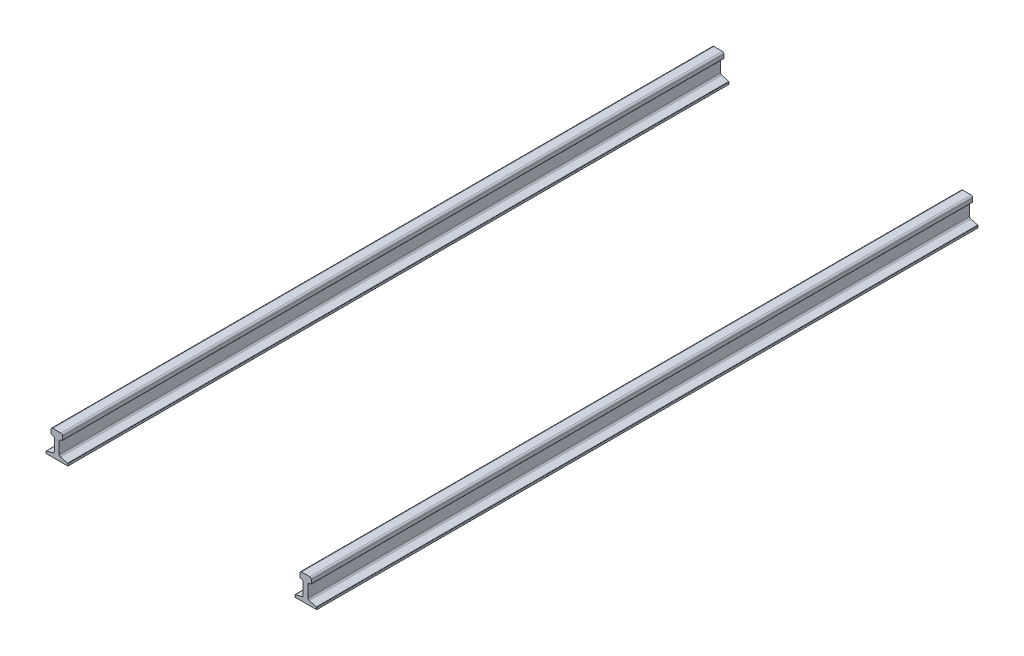
from build123d import *

# Parameters (mm, degrees)
EXTRUDE_1_DEPTH        = 4000
FILLET_1_R             = 10
FILLET_2_R             = 8
FILLET_3_R             = 3
FILLET_4_R             = 10
FILLET_5_R             = 3
PATTERN_LINEAR_1_COUNT = 2
PATTERN_LINEAR_1_PITCH = 1505


with BuildPart() as part:
    # 草图1 → 拉伸1 (new body)
    with BuildSketch(Plane.XY):
        Polygon((-35, 49.6), (-35, 83.5), (35, 83.5), (35, 49.6), (15, 44.6), (15, -41.6), (67, -54.6), (67, -68.5), (-65, -68.5), (-65, -54.6), (-15, -42.1), (-15, 44.6), align=None)
    extrude(amount=-EXTRUDE_1_DEPTH)

    # 圆角1
    fillet_1_edges = [part.edges().sort_by_distance(p)[0] for p in [
        (15, -41.6, -2000),
        (-15, -42.1, -2000),
    ]]
    fillet(fillet_1_edges, radius=FILLET_1_R)

    # 圆角2
    fillet_2_edges = [part.edges().sort_by_distance(p)[0] for p in [
        (15, 44.6, -2000),
        (-15, 44.6, -2000),
    ]]
    fillet(fillet_2_edges, radius=FILLET_2_R)

    # 圆角3
    fillet_3_edges = [part.edges().sort_by_distance(p)[0] for p in [
        (-35, 49.6, -2000),
        (35, 49.6, -2000),
    ]]
    fillet(fillet_3_edges, radius=FILLET_3_R)

    # 圆角4
    fillet_4_edges = [part.edges().sort_by_distance(p)[0] for p in [
        (-35, 83.5, -2000),
        (35, 83.5, -2000),
    ]]
    fillet(fillet_4_edges, radius=FILLET_4_R)

    # 圆角5
    fillet_5_edges = [part.edges().sort_by_distance(p)[0] for p in [
        (67, -54.6, -2000),
        (-65, -54.6, -2000),
    ]]
    fillet(fillet_5_edges, radius=FILLET_5_R)


with BuildPart() as pattern_linear_1_1:
    # 阵列(线性)1: pattern copy
    add(part.part.moved(Location(Vector(-1, 0, 0) * (1 * PATTERN_LINEAR_1_PITCH))))


solid = Compound([part.part, pattern_linear_1_1.part])
